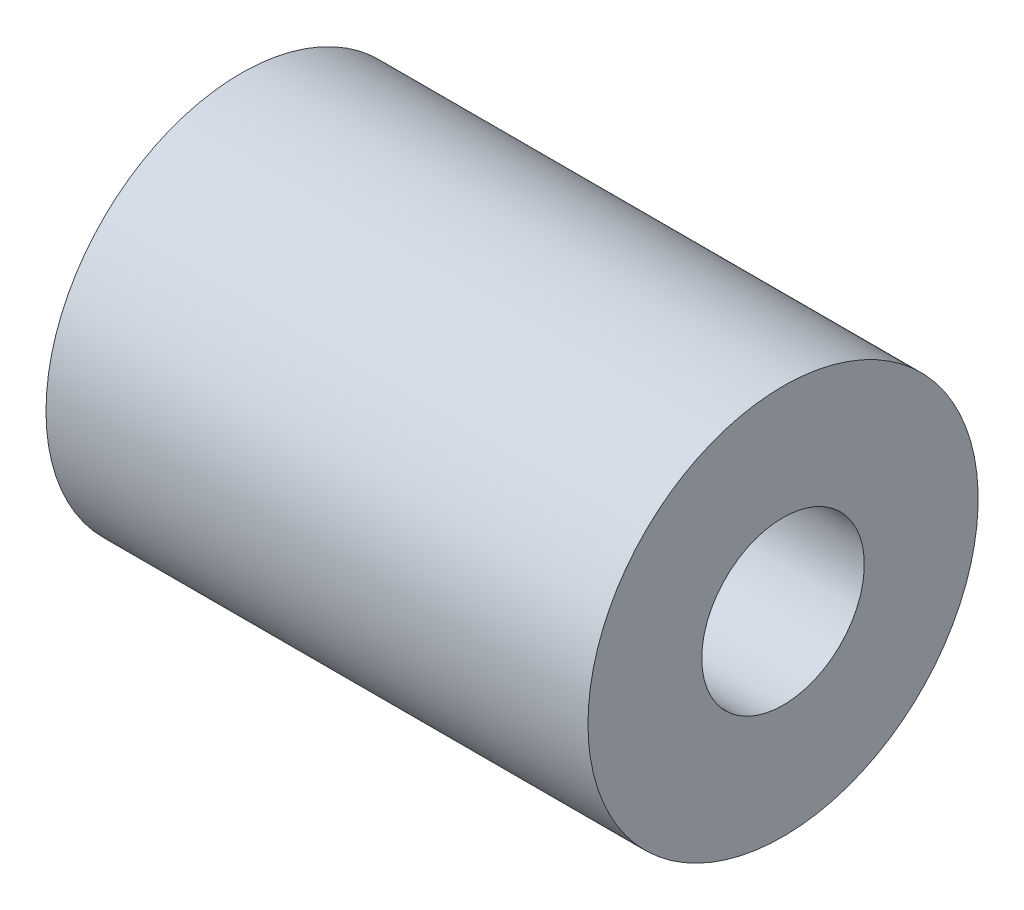
from build123d import *

# Parameters (mm, degrees)
SKETCH_1_W = 10
SKETCH_1_H = 2.1


with BuildPart() as part:
    # 草图1 → 旋转1 (revolve)
    with BuildSketch(Plane.XY, mode=Mode.PRIVATE) as revolve_1_sk:
        with Locations((-5, 2.55)):
            Rectangle(SKETCH_1_W, SKETCH_1_H)
    revolve(revolve_1_sk.sketch.rotate(Axis((-25.011627907, 0, 0), (1, 0, 0)), 90), axis=Axis((-25.011627907, 0, 0), (1, 0, 0)))


solid = part.part
